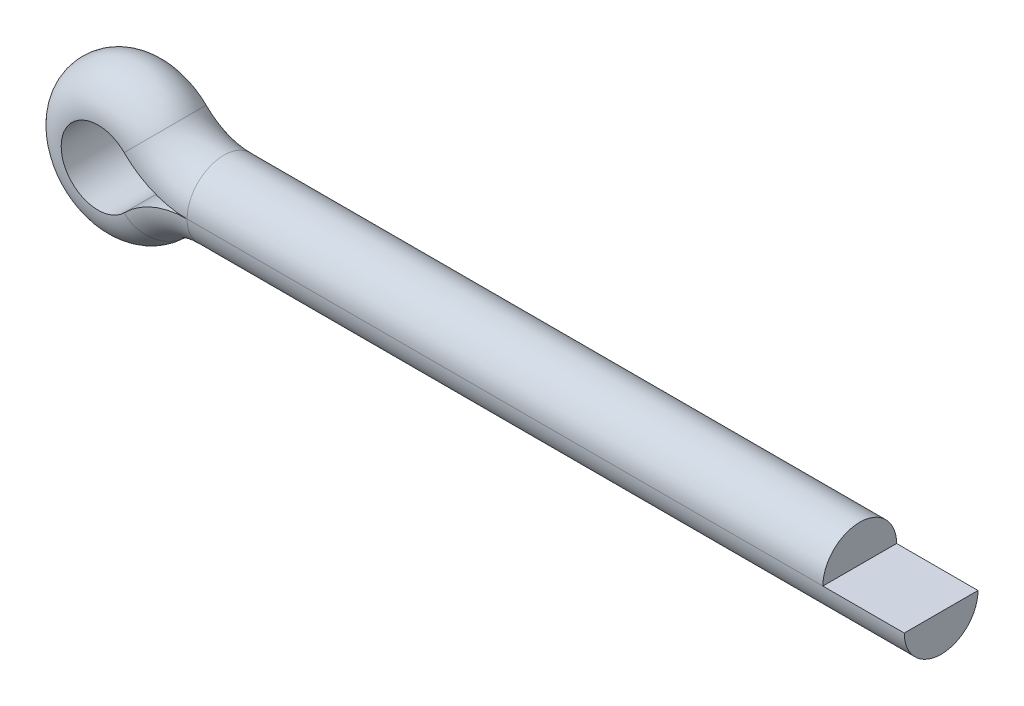
from build123d import *


with BuildPart() as part:
    # Body: sweep along a path in PathSke
    with BuildLine(Plane(origin=(1.207969362, 1.807969362, 0), x_dir=(0, 1, 0), z_dir=(0, 0, 1))) as body_path:
        Line((-0.357969362, -30.192030638), (-0.357969362, -5.192030638))
        ThreePointArc((-0.357969362, -5.192030638), (-0.201939729, -4.407742914), (0.242387718, -3.742892857))
        ThreePointArc((0.242387718, -3.742892857), (-1.807969362, 1.207969362), (-3.858326443, -3.742892857))
        ThreePointArc((-3.858326443, -3.742892857), (-3.413998995, -4.407742914), (-3.257969362, -5.192030638))
        Line((-3.257969362, -5.192030638), (-3.257969362, -33.392030638))
    # SectionSke → Body (sweep)
    with BuildSketch(Plane(origin=(31.4, 0.15, 0.15), x_dir=(0, 1, 0), z_dir=(1, 0, 0))):
        with BuildLine():
            Line((-0.15, -1.6), (-0.15, 1.3))
            ThreePointArc((-0.15, 1.3), (1.3, -0.15), (-0.15, -1.6))
        make_face()
    sweep(path=body_path.line)


solid = part.part
